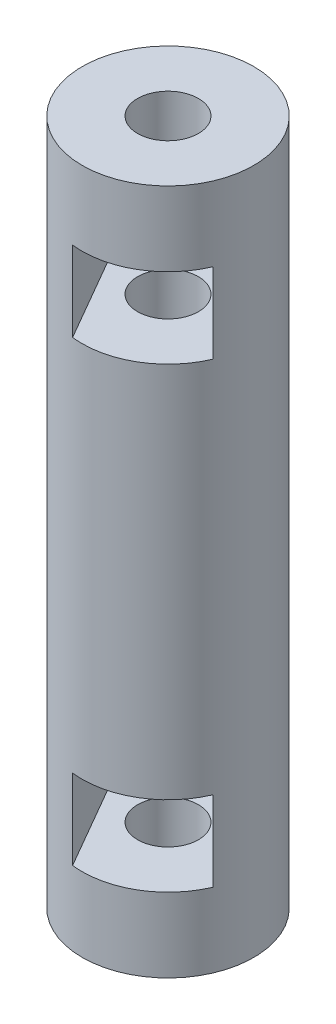
from build123d import *

# Parameters (mm, degrees)
SKETCH1_R           = 9.525
BOSS_EXTRUDE1_DEPTH = 38.1
CUT_EXTRUDE1_DEPTH  = 4.445
SKETCH3_R           = 3.3782
CUT_EXTRUDE2_DEPTH  = 78.381465804


with BuildPart() as part:
    # Sketch1 → Boss-Extrude1 (new, symmetric)
    with BuildSketch(Plane(origin=(0, 0, 0), x_dir=(1, 0, 0), z_dir=(0, 1, 0))):
        with Locations(Location((0, 0, 0), (0, 0, 90))):
            Circle(SKETCH1_R)
    extrude(amount=BOSS_EXTRUDE1_DEPTH, both=True)

    # Sketch2 → Cut-Extrude1 (cut, symmetric)
    with BuildSketch(Plane(origin=(0, -25.4, 0), x_dir=(-1, 0, 0), z_dir=(0, -1, 0))):
        Polygon((-3.299556788, 5.715), (-6.599113577, 0), (6.599113577, 0), (3.299556788, 5.715), align=None)
        Polygon((6.599113577, 0), (-6.599113577, 0), (-3.299556788, -5.715), (3.299556788, -5.715), align=None)
        with BuildLine():
            ThreePointArc((1.139335183, -9.456613577), (-4.7625, -8.248891971), (-8.759335183, -3.741613577))
            Line((-8.759335183, -3.741613577), (-6.599113577, 0))
            Line((-6.599113577, 0), (-3.299556788, -5.715))
            Line((-3.299556788, -5.715), (3.299556788, -5.715))
            Line((3.299556788, -5.715), (1.139335183, -9.456613577))
        make_face()
    cut_extrude1 = extrude(amount=CUT_EXTRUDE1_DEPTH, both=True, mode=Mode.SUBTRACT)

    # Mirror1: Cut-Extrude1 across plane
    add(cut_extrude1.mirror(Plane.ZX), mode=Mode.SUBTRACT)

    # Sketch3 → Cut-Extrude2 (cut, through all)
    with BuildSketch(Plane(origin=(0, 38.1, 0), x_dir=(1, 0, 0), z_dir=(0, 1, 0))):
        with Locations(Location((0, 0, 0), (0, 0, 270))):
            Circle(SKETCH3_R)
    extrude(amount=-CUT_EXTRUDE2_DEPTH, mode=Mode.SUBTRACT)


solid = part.part
